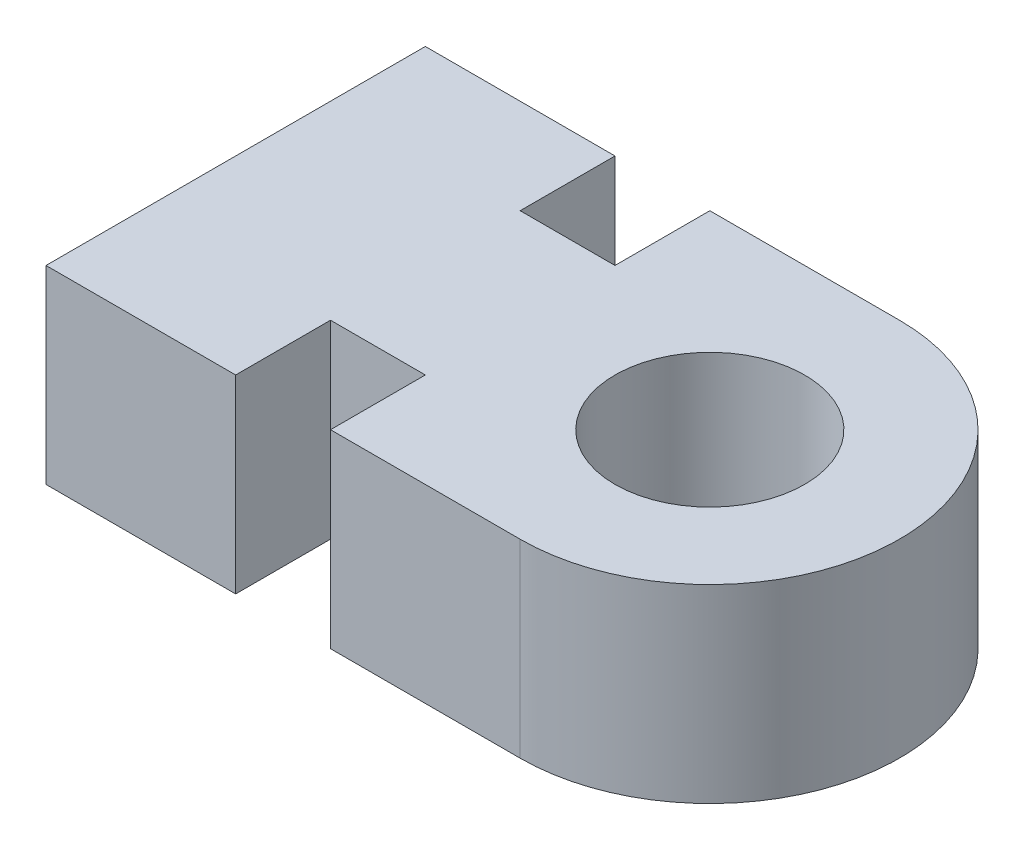
from build123d import *

# Parameters (mm, degrees)
SKETCH1_R           = 10
BOSS_EXTRUDE1_DEPTH = 20


with BuildPart() as part:
    # Sketch1 → Boss-Extrude1 (new body)
    with BuildSketch(Plane(origin=(0, 0, 0), x_dir=(1, 0, 0), z_dir=(0, 1, 0))):
        with BuildLine():
            Line((0, 20), (-20, 20))
            Line((-20, 20), (-20, 10))
            Line((-20, 10), (-30, 10))
            Line((-30, 10), (-30, 20))
            Line((-30, 20), (-50, 20))
            Line((-50, 20), (-50, -20))
            Line((-50, -20), (-30, -20))
            Line((-30, -20), (-30, -10))
            Line((-30, -10), (-20, -10))
            Line((-20, -10), (-20, -20))
            Line((-20, -20), (0, -20))
            ThreePointArc((0, -20), (20, 0), (0, 20))
        make_face()
        with Locations(Location((0, 0, 0), (0, 0, 270))):
            Circle(SKETCH1_R, mode=Mode.SUBTRACT)
    extrude(amount=BOSS_EXTRUDE1_DEPTH)


solid = part.part
